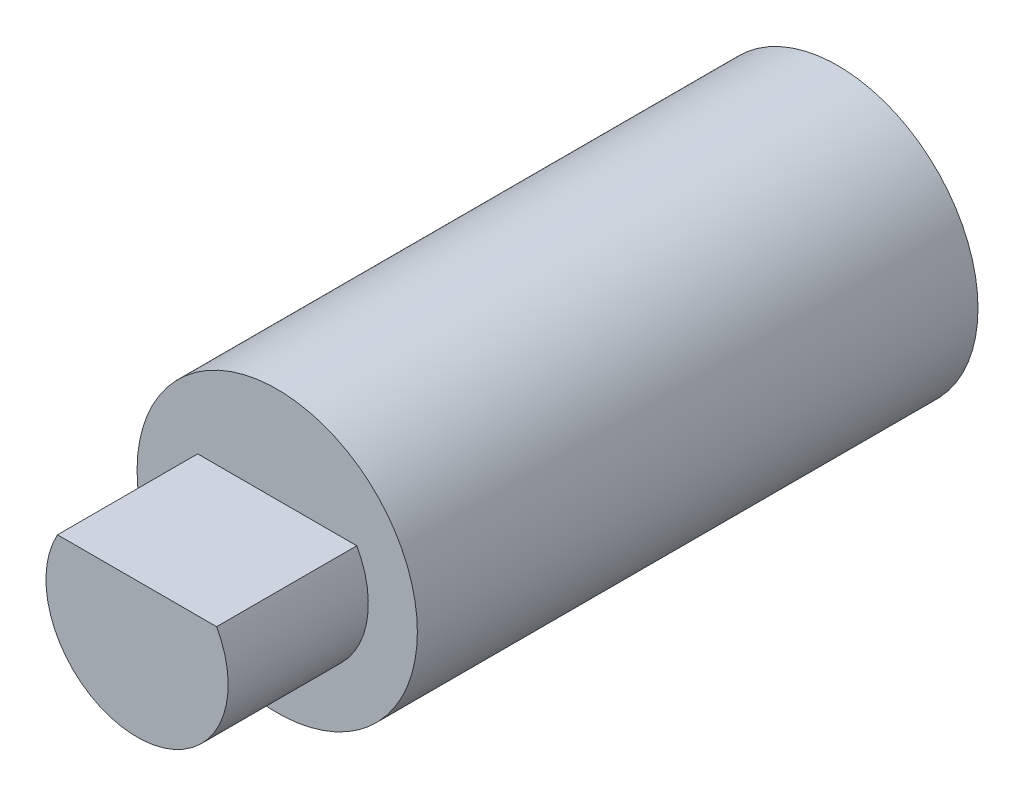
from build123d import *

# Parameters (mm, degrees)
SKETCH1_R           = 3
BOSS_EXTRUDE1_DEPTH = 10
SKETCH2_R           = 3
BOSS_EXTRUDE2_DEPTH = 2
BOSS_EXTRUDE3_DEPTH = 3


with BuildPart() as part:
    # Sketch1 → Boss-Extrude1 (new body)
    with BuildSketch(Plane.XY):
        Circle(SKETCH1_R)
        with BuildLine():
            Line((-1.161895004, 1.1), (1.161895004, 1.1))
            ThreePointArc((1.161895004, 1.1), (0, -1.6), (-1.161895004, 1.1))
        make_face(mode=Mode.SUBTRACT)
    extrude(amount=BOSS_EXTRUDE1_DEPTH)

    # Sketch2 → Boss-Extrude2 (add)
    with BuildSketch(Plane.XY.offset(10)):
        Circle(SKETCH2_R)
    extrude(amount=BOSS_EXTRUDE2_DEPTH)

    # Sketch3 → Boss-Extrude3 (add)
    with BuildSketch(Plane.XY.offset(12)):
        with BuildLine():
            Line((-1.702938637, 0.95), (1.702938637, 0.95))
            ThreePointArc((1.702938637, 0.95), (0, -1.95), (-1.702938637, 0.95))
        make_face()
    extrude(amount=BOSS_EXTRUDE3_DEPTH)


solid = part.part
